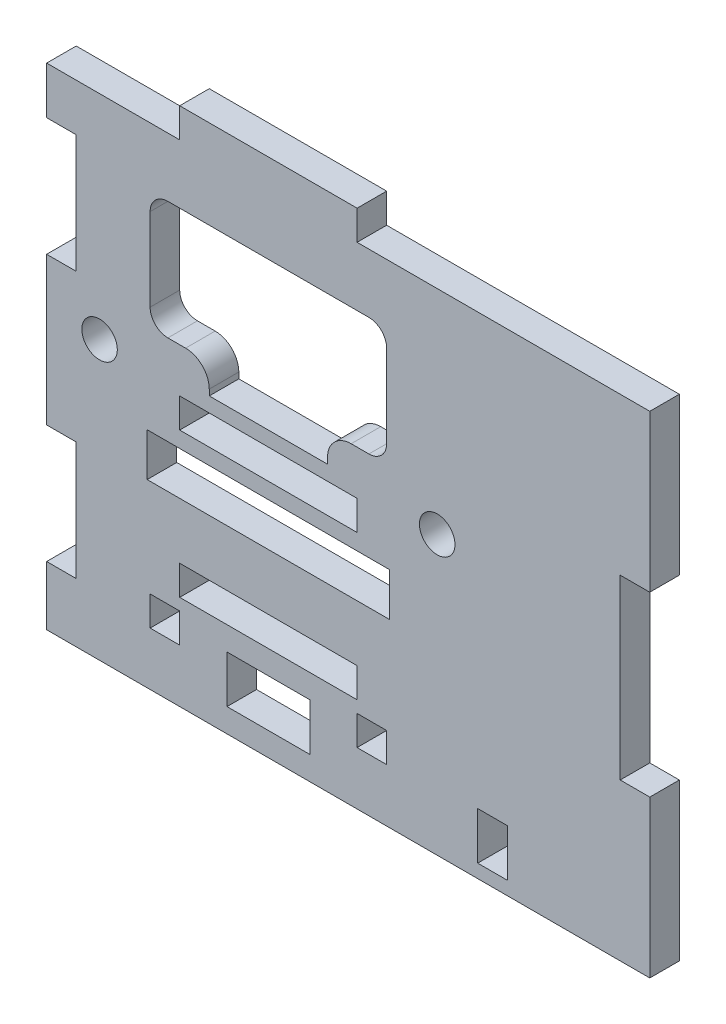
from build123d import *

# Parameters (mm, degrees)
SKETCH_1_R      = 3
SKETCH_1_W      = 30
SKETCH_1_H      = 5
SKETCH_1_W_2    = 5
SKETCH_1_W_3    = 14
SKETCH_1_H_2    = 8
SKETCH_1_W_4    = 41
SKETCH_1_H_3    = 7.3
EXTRUDE_1_DEPTH = 5


with BuildPart() as part:
    # 草图1 → 凸台-拉伸1 (new body)
    with BuildSketch(Plane.XY):
        Polygon((-77.5, 0), (24.5, 0), (24.5, 26.5), (19.5, 26.5), (19.5, 56.5), (24.5, 56.5), (24.5, 83), (-25, 83), (-25, 88), (-55, 88), (-55, 83), (-77.5, 83), (-77.5, 75), (-72.5, 75), (-72.5, 55), (-77.5, 55), (-77.5, 30), (-72.5, 30), (-72.5, 10), (-77.5, 10), align=None)
        with Locations((-68.55, 47)):
            Circle(SKETCH_1_R, mode=Mode.SUBTRACT)
        with Locations((-11.45, 47)):
            Circle(SKETCH_1_R, mode=Mode.SUBTRACT)
        with BuildLine():
            Line((-57, 53), (-54, 53))
            ThreePointArc((-54, 53), (-51.171572875, 51.828427125), (-50, 49))
            Line((-50, 49), (-50, 48))
            Line((-50, 48), (-30, 48))
            Line((-30, 48), (-30, 49))
            ThreePointArc((-30, 49), (-28.828427125, 51.828427125), (-26, 53))
            Line((-26, 53), (-23, 53))
            ThreePointArc((-23, 53), (-20.878679656, 53.878679656), (-20, 56))
            Line((-20, 56), (-20, 70))
            ThreePointArc((-20, 70), (-20.878679656, 72.121320344), (-23, 73))
            Line((-23, 73), (-57, 73))
            ThreePointArc((-57, 73), (-59.121320344, 72.121320344), (-60, 70))
            Line((-60, 70), (-60, 56))
            ThreePointArc((-60, 56), (-59.121320344, 53.878679656), (-57, 53))
        make_face(mode=Mode.SUBTRACT)
        with Locations((-40, 43)):
            Rectangle(SKETCH_1_W, SKETCH_1_H, mode=Mode.SUBTRACT)
        Polygon((-55, 16), (-50, 16), (-30, 16), (-25, 16), (-25, 21), (-55, 21), align=None, mode=Mode.SUBTRACT)
        with Locations((-57.5, 11.5)):
            Rectangle(SKETCH_1_W_2, SKETCH_1_H, mode=Mode.SUBTRACT)
        with Locations((-22.5, 11.5)):
            Rectangle(SKETCH_1_W_2, SKETCH_1_H, mode=Mode.SUBTRACT)
        with Locations((-40, 8)):
            Rectangle(SKETCH_1_W_3, SKETCH_1_H_2, mode=Mode.SUBTRACT)
        with Locations((-40, 34.15)):
            Rectangle(SKETCH_1_W_4, SKETCH_1_H_3, mode=Mode.SUBTRACT)
        with Locations((-2.1, 6.27)):
            Rectangle(SKETCH_1_W_2, SKETCH_1_H_2, mode=Mode.SUBTRACT)
    extrude(amount=EXTRUDE_1_DEPTH)


solid = part.part
